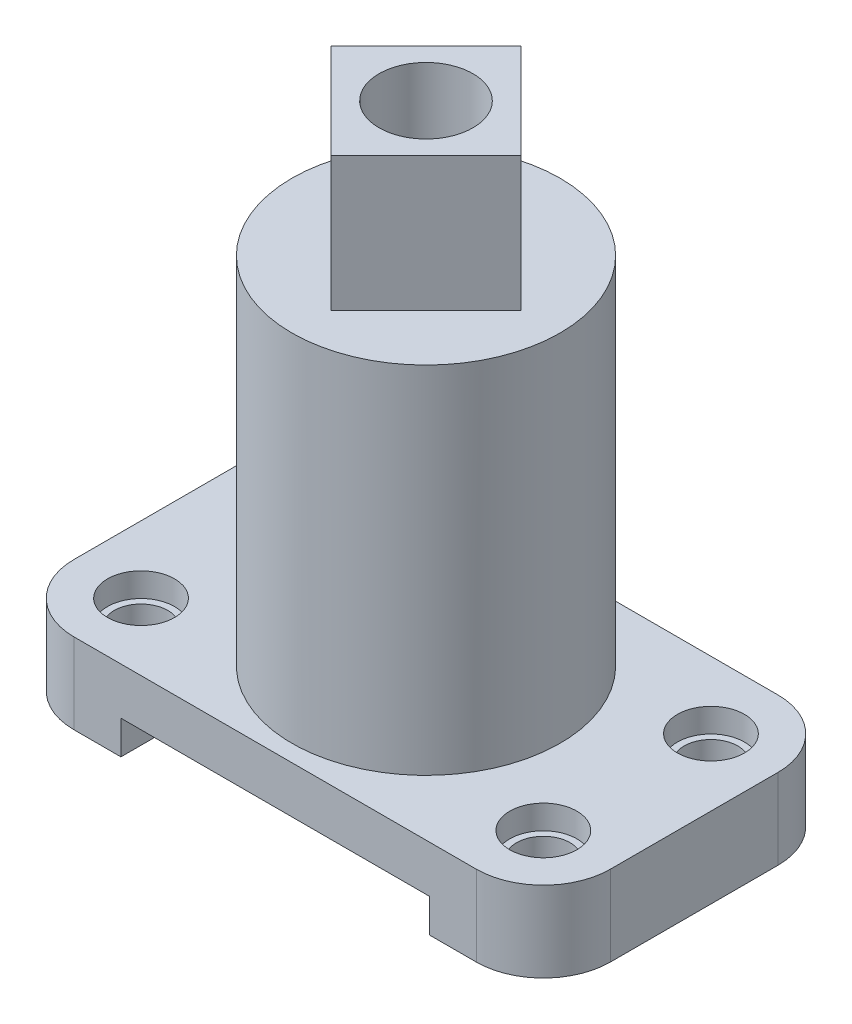
from build123d import *

# Parameters (mm, degrees)
BOSS_EXTRUDE1_DEPTH                     = 12
CBORE_FOR_M5_HEX_HEAD_BOLT1_D           = 8
CBORE_FOR_M5_HEX_HEAD_BOLT1_CBORE_D     = 10
CBORE_FOR_M5_HEX_HEAD_BOLT1_CBORE_DEPTH = 3.58
SKETCH4_R                               = 20
BOSS_EXTRUDE2_DEPTH                     = 53
BOSS_EXTRUDE3_DEPTH                     = 20
CBORE_FOR_M5_HEX_HEAD_BOLT5_D           = 10
CBORE_FOR_M5_HEX_HEAD_BOLT5_DEPTH       = 25
CBORE_FOR_M5_HEX_HEAD_BOLT5_CBORE_D     = 14
CBORE_FOR_M5_HEX_HEAD_BOLT5_CBORE_DEPTH = 18
CBORE_FOR_M5_HEX_HEAD_BOLT5_TIP         = 3.004303095
SKETCH11_W                              = 46
SKETCH11_H                              = 10
CUT_EXTRUDE1_DEPTH                      = 105.16333328


with BuildPart() as part:
    # Sketch2 → Boss-Extrude1 (new body)
    with BuildSketch(Plane(origin=(0, 0, 0), x_dir=(1, 0, 0), z_dir=(0, 1, 0))):
        with BuildLine():
            Line((-30, -22.5), (30, -22.5))
            ThreePointArc((30, -22.5), (37.071067812, -19.571067812), (40, -12.5))
            Line((40, -12.5), (40, 12.5))
            ThreePointArc((40, 12.5), (37.071067812, 19.571067812), (30, 22.5))
            Line((30, 22.5), (-30, 22.5))
            ThreePointArc((-30, 22.5), (-37.071067812, 19.571067812), (-40, 12.5))
            Line((-40, 12.5), (-40, -12.5))
            ThreePointArc((-40, -12.5), (-37.071067812, -19.571067812), (-30, -22.5))
        make_face()
    extrude(amount=BOSS_EXTRUDE1_DEPTH)

    # CBORE for M5 Hex Head Bolt1 (through all)
    with Locations(Plane(origin=(-30, 12, 12.5), x_dir=(0, 0, 1), z_dir=(0, 1, 0))):
        with Locations((0, 0), (-25, 0), (-25, 60), (0, 60)):
            CounterBoreHole(CBORE_FOR_M5_HEX_HEAD_BOLT1_D / 2, CBORE_FOR_M5_HEX_HEAD_BOLT1_CBORE_D / 2, CBORE_FOR_M5_HEX_HEAD_BOLT1_CBORE_DEPTH)

    # Sketch4 → Boss-Extrude2 (add)
    with BuildSketch(Plane(origin=(0, 12, 0), x_dir=(1, 0, 0), z_dir=(0, 1, 0))):
        with Locations(Location((0, 0, 0), (0, 0, 90))):
            Circle(SKETCH4_R)
    extrude(amount=BOSS_EXTRUDE2_DEPTH)

    # Sketch5 → Boss-Extrude3 (add)
    with BuildSketch(Plane(origin=(0, 65, 0), x_dir=(1, 0, 0), z_dir=(0, 1, 0))):
        Polygon((0, -14.142135624), (14.142135624, 0), (0, 14.142135624), (-14.142135624, 0), align=None)
    extrude(amount=BOSS_EXTRUDE3_DEPTH)

    # CBORE for M5 Hex Head Bolt5
    with Locations(Plane.ZX.offset(85)):
        with Locations((0, 0)):
            CounterBoreHole(CBORE_FOR_M5_HEX_HEAD_BOLT5_D / 2, CBORE_FOR_M5_HEX_HEAD_BOLT5_CBORE_D / 2, CBORE_FOR_M5_HEX_HEAD_BOLT5_CBORE_DEPTH, depth=CBORE_FOR_M5_HEX_HEAD_BOLT5_DEPTH)
            with Locations((0, 0, -(CBORE_FOR_M5_HEX_HEAD_BOLT5_DEPTH + CBORE_FOR_M5_HEX_HEAD_BOLT5_TIP / 2))):  # 118° drill point
                Cone(0, CBORE_FOR_M5_HEX_HEAD_BOLT5_D / 2, CBORE_FOR_M5_HEX_HEAD_BOLT5_TIP, mode=Mode.SUBTRACT)

    # Sketch10 → Cut-Revolve1 (revolve, cut)
    with BuildSketch(Plane.XY):
        with BuildLine():
            Line((0, 0), (0, 54))
            ThreePointArc((0, 54), (-9.899494937, 49.899494937), (-14, 40))
            Line((-14, 40), (-14, 0))
            Line((-14, 0), (0, 0))
        make_face()
    revolve(axis=Axis((0, 0, 0), (0, 1, 0)), mode=Mode.SUBTRACT)

    # Sketch11 → Cut-Extrude1 (cut, through all)
    with BuildSketch(Plane.XY.offset(22.5)):
        Rectangle(SKETCH11_W, SKETCH11_H)
    extrude(amount=-CUT_EXTRUDE1_DEPTH, mode=Mode.SUBTRACT)


solid = part.part
